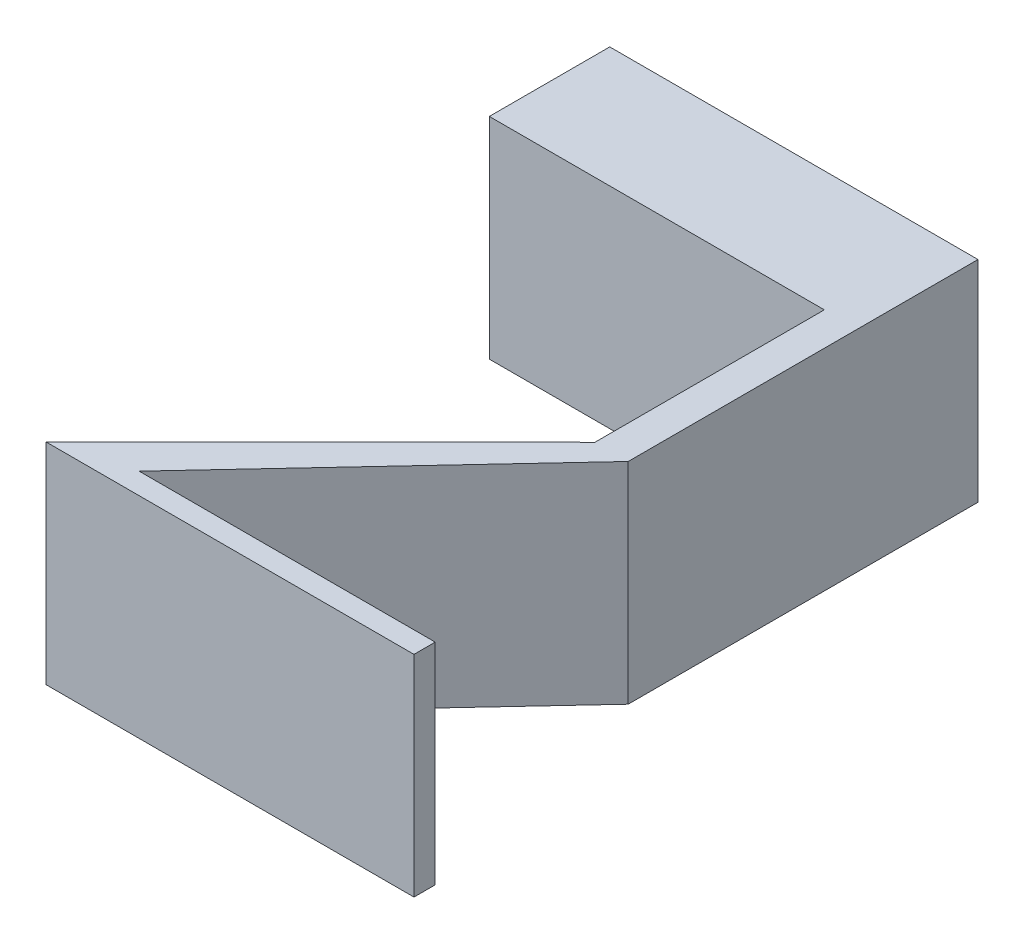
from build123d import *

# Parameters (mm, degrees)
SKETCH1_W           = 139.457769838
SKETCH1_H           = 99.02864438
BOSS_EXTRUDE1_DEPTH = 10
BOSS_EXTRUDE2_DEPTH = 99.028644381
BOSS_EXTRUDE3_DEPTH = 99.028644381


with BuildPart() as part:
    # Sketch1 → Boss-Extrude1 (new body)
    with BuildSketch(Plane.XY):
        Rectangle(SKETCH1_W, SKETCH1_H)
    extrude(amount=BOSS_EXTRUDE1_DEPTH)

    # Sketch2 → Boss-Extrude2 (add)
    with BuildSketch(Plane(origin=(0, 49.51432219, 0), x_dir=(1, 0, 0), z_dir=(0, 1, 0))):
        Polygon((-69.728884919, 0), (41.491223437, 119.146703645), (25.829944634, 119.146703645), (-103.609221326, -10), (-69.728884919, -10), align=None)
    extrude(amount=-BOSS_EXTRUDE2_DEPTH)

    # Sketch3 → Boss-Extrude3 (add)
    with BuildSketch(Plane(origin=(0, 49.51432219, 0), x_dir=(1, 0, 0), z_dir=(0, 1, 0))):
        Polygon((41.491223437, 119.146703645), (41.491223437, 283.914864742), (-131.976237247, 283.914864742), (-131.976237247, 227.19452677), (25.829944634, 227.19452677), (25.829944634, 119.146703645), align=None)
    extrude(amount=-BOSS_EXTRUDE3_DEPTH)


solid = part.part
